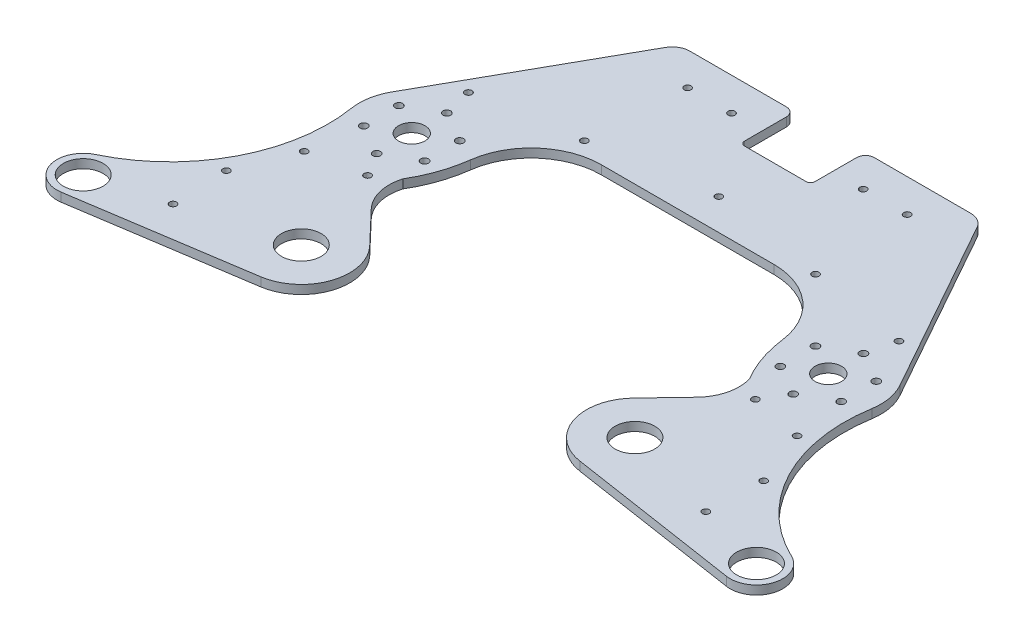
from build123d import *

# Parameters (mm, degrees)
CROQUIS2_R              = 14.3256
SALIENTE_EXTRUIR1_DEPTH = 6.35
CROQUIS2_4_W            = 50.8762
CROQUIS2_4_H            = 39.6875
CROQUIS2_4_R            = 9.5631
CROQUIS2_4_R_2          = 2.75
CORTAR_EXTRUIR1_DEPTH   = 371.910058047
CROQUIS14_R             = 2.4892
CORTAR_EXTRUIR2_DEPTH   = 371.910058047
REDONDEO1_R             = 6.35
REDONDEO2_R             = 3.175


with BuildPart() as part:
    # Croquis2 → Saliente-Extruir1 (new body)
    with BuildSketch(Plane(origin=(0, 0, 0), x_dir=(1, 0, 0), z_dir=(0, 1, 0))):
        with BuildLine():
            ThreePointArc((-188.182128671, 103.759608663), (-199.701715383, 32.430892727), (-251.69762296, -17.737944119))
            ThreePointArc((-251.69762296, -17.737944119), (-261.686817555, -40.53413651), (-240.600442924, -53.755906478))
            Line((-240.600442924, -53.755906478), (-115.357366493, -34.595379464))
            ThreePointArc((-115.357366493, -34.595379464), (-87.525854425, -11.297930327), (-95.320323823, 24.150771302))
            Line((-95.320323823, 24.150771302), (-117.919425507, 47.853034074))
            ThreePointArc((-117.919425507, 47.853034074), (-125.667640352, 61.991051501), (-125.359085671, 78.110082616))
            ThreePointArc((-125.359085671, 78.110082616), (-117.209880411, 95.622258218), (-112.798586764, 114.427213125))
            ThreePointArc((-112.798586764, 114.427213125), (-95.966139935, 146.092380804), (-62.413214778, 158.75))
            Line((-62.413214778, 158.75), (62.413214778, 158.75))
            ThreePointArc((62.413214778, 158.75), (95.966139935, 146.092380804), (112.798586764, 114.427213125))
            ThreePointArc((112.798586764, 114.427213125), (117.209880411, 95.622258218), (125.359085671, 78.110082616))
            ThreePointArc((125.359085671, 78.110082616), (125.667640352, 61.991051501), (117.919425507, 47.853034074))
            Line((117.919425507, 47.853034074), (95.320323823, 24.150771302))
            ThreePointArc((95.320323823, 24.150771302), (87.525854425, -11.297930327), (115.357366493, -34.595379464))
            Line((115.357366493, -34.595379464), (240.600442924, -53.755906478))
            ThreePointArc((240.600442924, -53.755906478), (261.686817555, -40.53413651), (251.69762296, -17.737944119))
            ThreePointArc((251.69762296, -17.737944119), (199.701715383, 32.430892727), (188.182128671, 103.759608663))
            ThreePointArc((188.182128671, 103.759608663), (188.098504611, 116.479155722), (183.824839077, 128.459541912))
            Line((183.824839077, 128.459541912), (112.679583494, 255.444981743))
            ThreePointArc((112.679583494, 255.444981743), (108.020863721, 260.194803914), (101.6, 261.9375))
            Line((101.6, 261.9375), (-101.6, 261.9375))
            ThreePointArc((-101.6, 261.9375), (-108.020863721, 260.194803914), (-112.679583494, 255.444981743))
            Line((-112.679583494, 255.444981743), (-183.824839077, 128.459541912))
            ThreePointArc((-183.824839077, 128.459541912), (-188.098504611, 116.479155722), (-188.182128671, 103.759608663))
        make_face()
        with Locations((-243.481321473, -34.925)):
            Circle(CROQUIS2_R, mode=Mode.SUBTRACT)
        with Locations((243.481321473, -34.925)):
            Circle(CROQUIS2_R, mode=Mode.SUBTRACT)
        with Locations((120.65, 0)):
            Circle(CROQUIS2_R, mode=Mode.SUBTRACT)
        with Locations((-120.65, 0)):
            Circle(CROQUIS2_R, mode=Mode.SUBTRACT)
    extrude(amount=SALIENTE_EXTRUIR1_DEPTH)

    # Croquis2<4> → Cortar-Extruir1 (cut, through all)
    with BuildSketch(Plane(origin=(0, 0, 0), x_dir=(1, 0, 0), z_dir=(0, 1, 0))):
        with Locations((0, 242.09375)):
            Rectangle(CROQUIS2_4_W, CROQUIS2_4_H)
        with Locations((150.65, 109.872903883)):
            Circle(CROQUIS2_4_R)
        with Locations((-150.65, 135.272903883)):
            Circle(CROQUIS2_4_R_2)
        with Locations((-128.652954744, 122.572903883)):
            Circle(CROQUIS2_4_R_2)
        with Locations((-128.652954744, 97.172903883)):
            Circle(CROQUIS2_4_R_2)
        with Locations((-150.65, 84.472903883)):
            Circle(CROQUIS2_4_R_2)
        with Locations((-172.647045256, 97.172903883)):
            Circle(CROQUIS2_4_R_2)
        with Locations((-172.647045256, 122.572903883)):
            Circle(CROQUIS2_4_R_2)
        with Locations((172.647045256, 122.572903883)):
            Circle(CROQUIS2_4_R_2)
        with Locations((172.647045256, 97.172903883)):
            Circle(CROQUIS2_4_R_2)
        with Locations((150.65, 84.472903883)):
            Circle(CROQUIS2_4_R_2)
        with Locations((128.652954744, 97.172903883)):
            Circle(CROQUIS2_4_R_2)
        with Locations((128.652954744, 122.572903883)):
            Circle(CROQUIS2_4_R_2)
        with Locations((150.65, 135.272903883)):
            Circle(CROQUIS2_4_R_2)
        with Locations((-150.65, 109.872903883)):
            Circle(CROQUIS2_4_R)
    extrude(amount=CORTAR_EXTRUIR1_DEPTH, mode=Mode.SUBTRACT)

    # Croquis14 → Cortar-Extruir2 (cut, through all)
    with BuildSketch(Plane(origin=(0, 6.35, 0), x_dir=(1, 0, 0), z_dir=(0, 1, 0))):
        with Locations((0, 181.2925)):
            Circle(CROQUIS14_R)
        with Locations((-192.681321473, -20.729393931)):
            Circle(CROQUIS14_R)
        with Locations((-194.31, 19.456295642)):
            Circle(CROQUIS14_R)
        with Locations((-178.243269302, 59.69)):
            Circle(CROQUIS14_R)
        with Locations((-47.625, 238.125)):
            Circle(CROQUIS14_R)
        with Locations((-79.375, 238.125)):
            Circle(CROQUIS14_R)
        with Locations((-140.226260019, 67.490403883)):
            Circle(CROQUIS14_R)
        with Locations((47.625, 238.125)):
            Circle(CROQUIS14_R)
        with Locations((79.375, 238.125)):
            Circle(CROQUIS14_R)
        with Locations((-83.62741479, 167.64)):
            Circle(CROQUIS14_R)
        with Locations((-155.704943728, 155.914794364)):
            Circle(CROQUIS14_R)
        with Locations((192.681321473, -20.729393931)):
            Circle(CROQUIS14_R)
        with Locations((194.31, 19.456295642)):
            Circle(CROQUIS14_R)
        with Locations((178.243269302, 59.69)):
            Circle(CROQUIS14_R)
        with Locations((140.226260019, 67.490403883)):
            Circle(CROQUIS14_R)
        with Locations((83.62741479, 167.64)):
            Circle(CROQUIS14_R)
        with Locations((155.704943728, 155.914794364)):
            Circle(CROQUIS14_R)
    extrude(amount=-CORTAR_EXTRUIR2_DEPTH, mode=Mode.SUBTRACT)

    # Redondeo1
    redondeo1_edges = [part.edges().sort_by_distance(p)[0] for p in [
        (25.4381, 3.175, -261.9375),
        (-25.4381, 3.175, -261.9375),
    ]]
    fillet(redondeo1_edges, radius=REDONDEO1_R)

    # Redondeo2
    redondeo2_edges = [part.edges().sort_by_distance(p)[0] for p in [
        (-25.4381, 3.175, -222.25),
        (25.4381, 3.175, -222.25),
    ]]
    fillet(redondeo2_edges, radius=REDONDEO2_R)


solid = part.part
